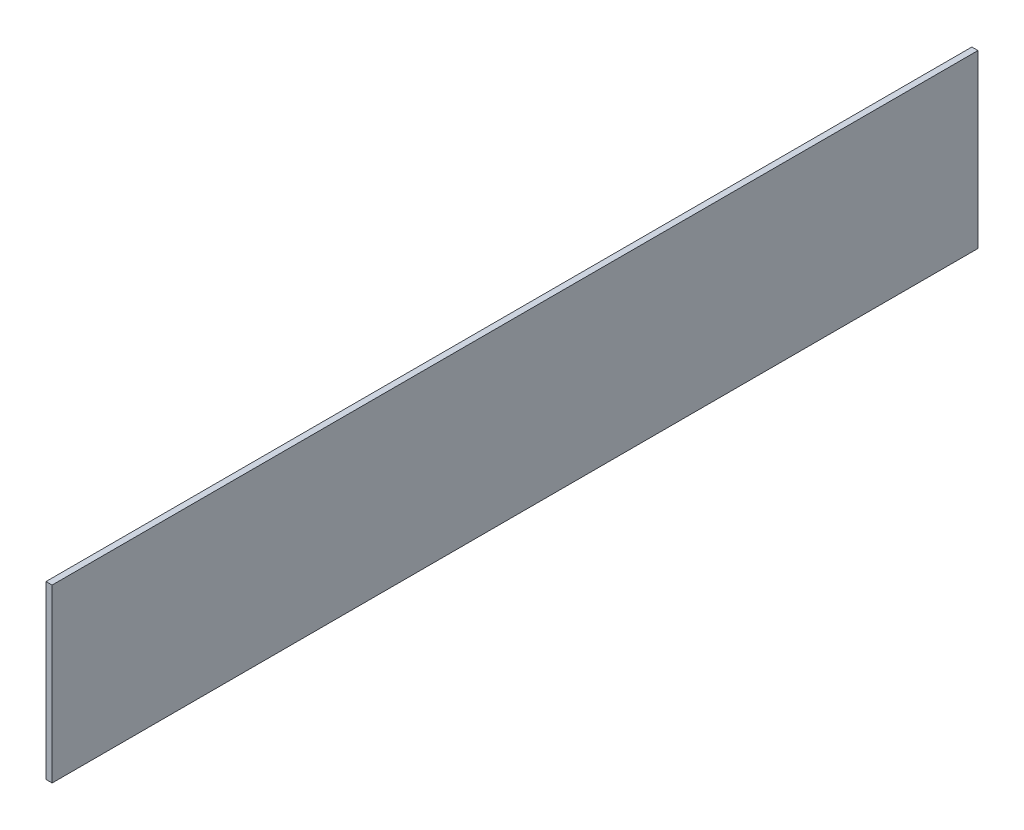
from build123d import *

# Parameters (mm, degrees)
SKETCH1_W           = 240.03
SKETCH1_H           = 44.45
BOSS_EXTRUDE1_DEPTH = 1.5875


with BuildPart() as part:
    # Sketch1 → Boss-Extrude1 (new body)
    with BuildSketch(Plane(origin=(0, 0, 0), x_dir=(0, 0, -1), z_dir=(1, 0, 0))):
        Rectangle(SKETCH1_W, SKETCH1_H)
    extrude(amount=BOSS_EXTRUDE1_DEPTH)


solid = part.part
